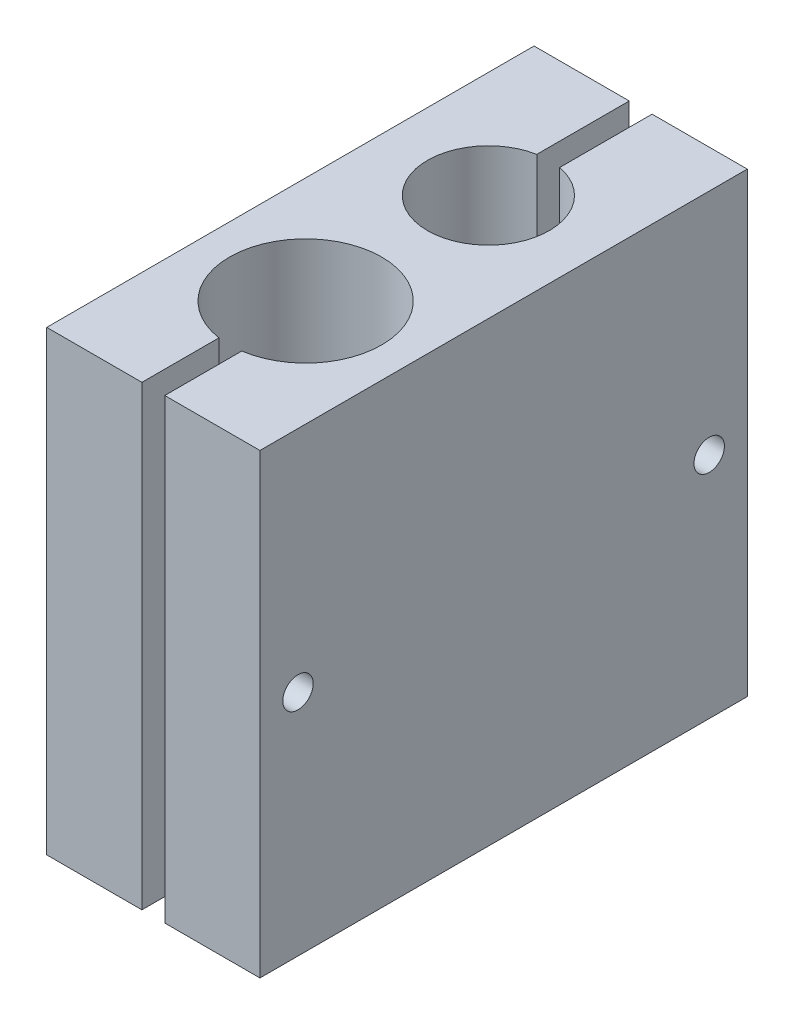
from build123d import *

# Parameters (mm, degrees)
SKETCH1_W           = 14
SKETCH1_H           = 32
SKETCH1_R           = 3.4
SKETCH1_R_2         = 4
BOSS_EXTRUDE1_DEPTH = 30
SKETCH2_R           = 5
CUT_EXTRUDE1_DEPTH  = 8
SKETCH3_W           = 1.5
SKETCH3_H           = 20
CUT_EXTRUDE2_DEPTH  = 38.854986461
SKETCH4_R           = 1
CUT_EXTRUDE3_DEPTH  = 40.749213829


with BuildPart() as part:
    # Sketch1 → Boss-Extrude1 (new body)
    with BuildSketch(Plane(origin=(0, 0, 0), x_dir=(1, 0, 0), z_dir=(0, 1, 0))):
        with Locations((0, 6)):
            Rectangle(SKETCH1_W, SKETCH1_H)
        with Locations(Location((0, 0, 0), (0, 0, 270))):
            Circle(SKETCH1_R, mode=Mode.SUBTRACT)
        with Locations(Location((0, 12, 0), (0, 0, 270))):
            Circle(SKETCH1_R_2, mode=Mode.SUBTRACT)
    extrude(amount=BOSS_EXTRUDE1_DEPTH)

    # Sketch2 → Cut-Extrude1 (cut)
    with BuildSketch(Plane(origin=(0, 30, 0), x_dir=(1, 0, 0), z_dir=(0, 1, 0))):
        with Locations(Location((0, 0, 0), (0, 0, 270))):
            Circle(SKETCH2_R)
    extrude(amount=-CUT_EXTRUDE1_DEPTH, mode=Mode.SUBTRACT)

    # Sketch3 → Cut-Extrude2 (cut, through all)
    with BuildSketch(Plane.XZ):
        with Locations((0, 10)):
            Rectangle(SKETCH3_W, SKETCH3_H)
        with Locations((0, -22)):
            Rectangle(SKETCH3_W, SKETCH3_H)
    extrude(amount=-CUT_EXTRUDE2_DEPTH, mode=Mode.SUBTRACT)

    # Sketch4 → Cut-Extrude3 (cut, through all)
    with BuildSketch(Plane.ZY.offset(7)):
        with Locations((7.5, 15)):
            Circle(SKETCH4_R)
        with Locations((-19.5, 15)):
            Circle(SKETCH4_R)
    extrude(amount=-CUT_EXTRUDE3_DEPTH, mode=Mode.SUBTRACT)


solid = part.part
